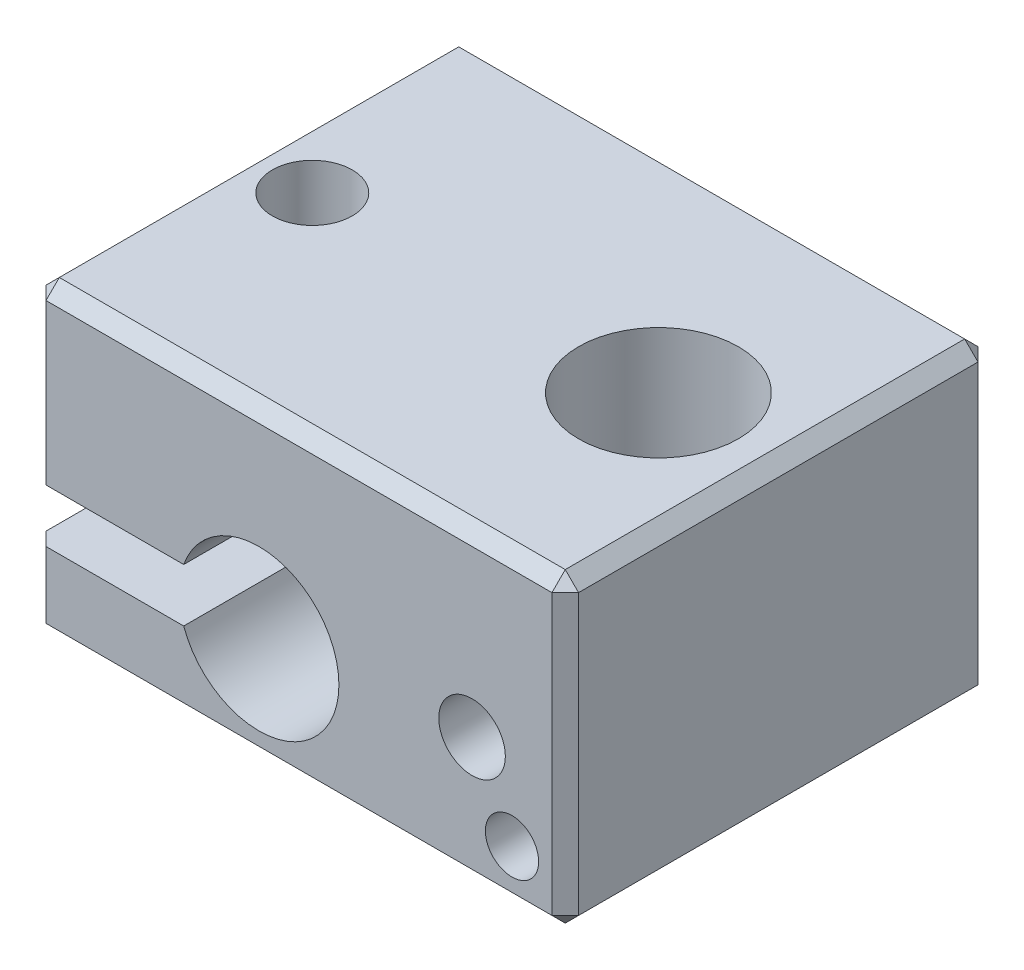
from build123d import *

# Parameters (mm, degrees)
SKETCH1_W           = 20
SKETCH1_H           = 16
SKETCH1_R           = 3
SKETCH1_R_2         = 1.5
BOSS_EXTRUDE1_DEPTH = 11.5
CUT_EXTRUDE1_DEPTH  = 23.096379794
SKETCH3_R           = 1.25
SKETCH3_R_2         = 1
CUT_EXTRUDE2_DEPTH  = 3
CHAMFER1_SIZE       = 0.5


with BuildPart() as part:
    # Sketch1 → Boss-Extrude1 (new body)
    with BuildSketch(Plane(origin=(0, 0, 0), x_dir=(1, 0, 0), z_dir=(0, 1, 0))):
        Rectangle(SKETCH1_W, SKETCH1_H)
        with Locations(Location((5.5, 0, 0), (0, 0, 270))):
            Circle(SKETCH1_R, mode=Mode.SUBTRACT)
        with Locations(Location((-7.5, 0, 0), (0, 0, 270))):
            Circle(SKETCH1_R_2, mode=Mode.SUBTRACT)
    extrude(amount=BOSS_EXTRUDE1_DEPTH)

    # Sketch2 → Cut-Extrude1 (cut, through all)
    with BuildSketch(Plane.XY.offset(8)):
        with BuildLine():
            Line((-10, 5), (-4.328427125, 5))
            ThreePointArc((-4.328427125, 5), (1.5, 4), (-4.328427125, 3))
            Line((-4.328427125, 3), (-10, 3))
            Line((-10, 3), (-10, 5))
        make_face()
    extrude(amount=-CUT_EXTRUDE1_DEPTH, mode=Mode.SUBTRACT)

    # Sketch3 → Cut-Extrude2 (cut)
    with BuildSketch(Plane.XY.offset(8)):
        with Locations((6.5, 4.8)):
            Circle(SKETCH3_R)
        with Locations((8, 2)):
            Circle(SKETCH3_R_2)
    extrude(amount=-CUT_EXTRUDE2_DEPTH, mode=Mode.SUBTRACT)

    # Chamfer1
    chamfer1_edges = [part.edges().sort_by_distance(p)[0] for p in [
        (10, 11.5, 0),
        (0, 11.5, -8),
        (-10, 1.5, -8),
        (-10, 1.5, 8),
        (-10, 11.5, 0),
        (0, 0, -8),
        (10, 0, 0),
        (0, 0, 8),
        (-10, 0, 0),
        (0, 11.5, 8),
        (-10, 8.25, -8),
        (10, 5.75, -8),
        (10, 5.75, 8),
        (-10, 8.25, 8),
    ]]
    chamfer(chamfer1_edges, length=CHAMFER1_SIZE)


solid = part.part
